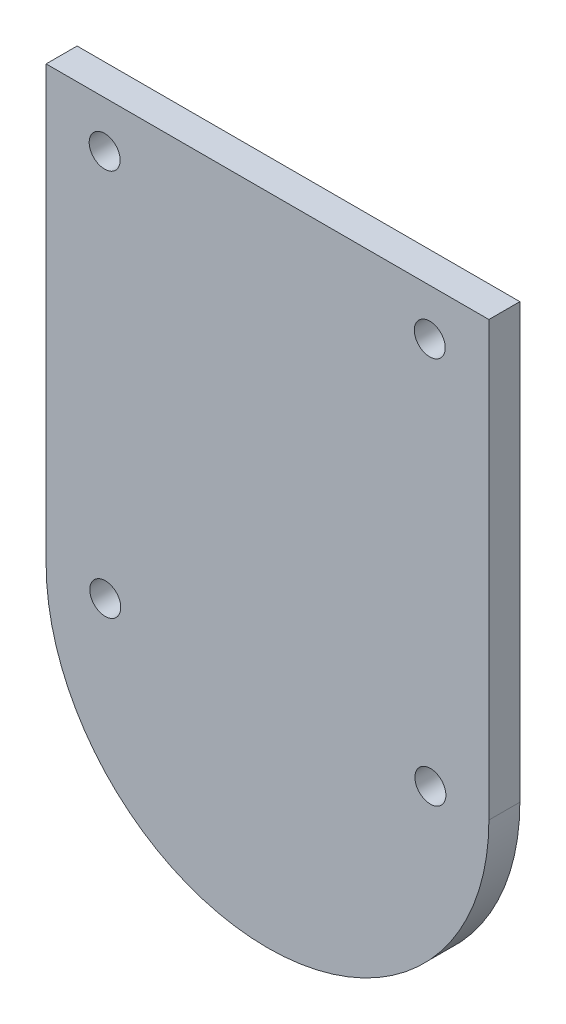
from build123d import *

# Parameters (mm, degrees)
SKETCH_1_R      = 1
EXTRUDE_1_DEPTH = 2


with BuildPart() as part:
    # 草图1 → 凸台-拉伸1 (new body)
    with BuildSketch(Plane.XY):
        with BuildLine():
            Line((0, 24.376794113), (28.6, 24.376794113))
            Line((28.6, 24.376794113), (28.6, -3.62321671))
            ThreePointArc((28.6, -3.62321671), (24.411626971, -13.734843681), (14.3, -17.92321671))
            ThreePointArc((14.3, -17.92321671), (4.188373029, -13.734843681), (0, -3.62321671))
            Line((0, -3.62321671), (0, 24.376794113))
        make_face()
        with Locations((24.78, 21.376794113)):
            Circle(SKETCH_1_R, mode=Mode.SUBTRACT)
        with Locations((3.78, 21.376794113)):
            Circle(SKETCH_1_R, mode=Mode.SUBTRACT)
        with Locations((3.82, -3.623205887)):
            Circle(SKETCH_1_R, mode=Mode.SUBTRACT)
        with Locations((24.82, -3.623205887)):
            Circle(SKETCH_1_R, mode=Mode.SUBTRACT)
    extrude(amount=EXTRUDE_1_DEPTH)


solid = part.part
